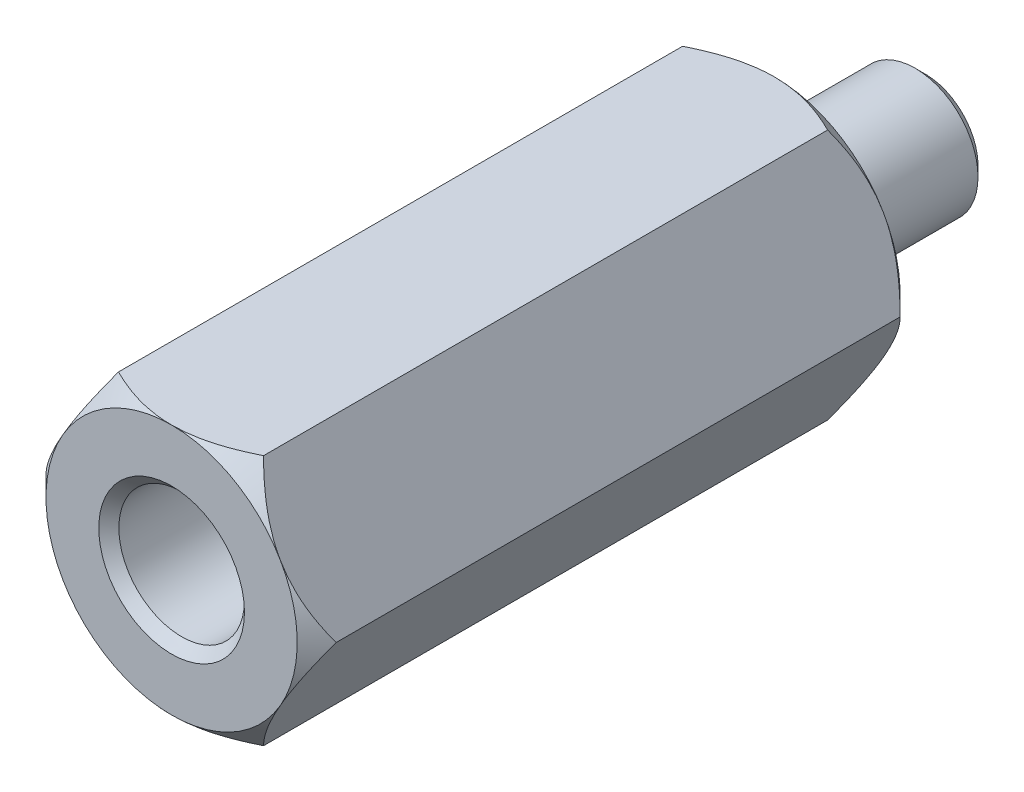
from build123d import *

# Parameters (mm, degrees)
BOSS_EXTRU_1_DEPTH      = 12
ESQUISSE3_R             = 1.25
ENL_V_MAT_EXTRU_1_DEPTH = 6
CHANFREIN1_SIZE         = 0.2
ESQUISSE4_R             = 1.25
BOSS_EXTRU_2_DEPTH      = 3
CHANFREIN2_SIZE         = 0.2


with BuildPart() as part:
    # Esquisse1 → Boss.-Extru.1 (new body)
    with BuildSketch(Plane.XY):
        Polygon((2.886751346, 0), (1.443375673, 2.5), (-1.443375673, 2.5), (-2.886751346, 0), (-1.443375673, -2.5), (1.443375673, -2.5), align=None)
    extrude(amount=BOSS_EXTRU_1_DEPTH)

    # Esquisse2 → Enlèvement de matière-Révolution1 (revolve, cut)
    with BuildSketch(Plane(origin=(0, 0, 0), x_dir=(1, 0, 0), z_dir=(0, 1, 0))):
        Polygon((-1.5, 1), (-3, -0.5), (-3, 1), align=None)
        Polygon((-3, -11.5), (-1.5, -13), (-3, -13), align=None)
    revolve(axis=Axis((0, 0, 0), (0, 0, 1)), mode=Mode.SUBTRACT)

    # Esquisse3 → Enlèv. mat.-Extru.1 (cut)
    with BuildSketch(Plane.XY.offset(12)):
        Circle(ESQUISSE3_R)
    extrude(amount=-ENL_V_MAT_EXTRU_1_DEPTH, mode=Mode.SUBTRACT)

    # Chanfrein1
    chanfrein1_edges = [part.edges().sort_by_distance(p)[0] for p in [
        (-1.25, 0, 12),
    ]]
    chamfer(chanfrein1_edges, length=CHANFREIN1_SIZE)

    # Esquisse4 → Boss.-Extru.2 (add)
    with BuildSketch(Plane(origin=(0, 0, 0), x_dir=(-1, 0, 0), z_dir=(0, 0, -1))):
        with Locations(Location((0, 0, 0), (0, 0, 180))):
            Circle(ESQUISSE4_R)
    extrude(amount=BOSS_EXTRU_2_DEPTH)

    # Chanfrein2
    chanfrein2_edges = [part.edges().sort_by_distance(p)[0] for p in [
        (-1.25, 0, -3),
    ]]
    chamfer(chanfrein2_edges, length=CHANFREIN2_SIZE)


solid = part.part
